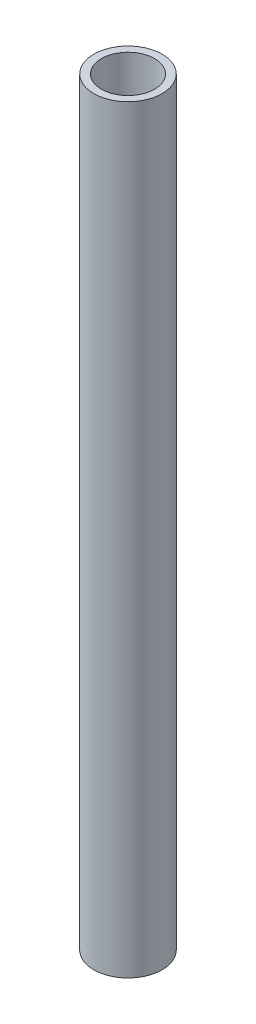
from build123d import *

# Parameters (mm, degrees)
ESQUISSE1_R        = 9
ESQUISSE1_R_2      = 7
BOSS_EXTRU_1_DEPTH = 200


with BuildPart() as part:
    # Esquisse1 → Boss.-Extru.1 (new body)
    with BuildSketch(Plane(origin=(0, 0, 0), x_dir=(1, 0, 0), z_dir=(0, 1, 0))):
        with Locations(Location((0, 0, 0), (0, 0, 270))):
            Circle(ESQUISSE1_R)
        with Locations(Location((0, 0, 0), (0, 0, 270))):
            Circle(ESQUISSE1_R_2, mode=Mode.SUBTRACT)
    extrude(amount=BOSS_EXTRU_1_DEPTH)


solid = part.part
